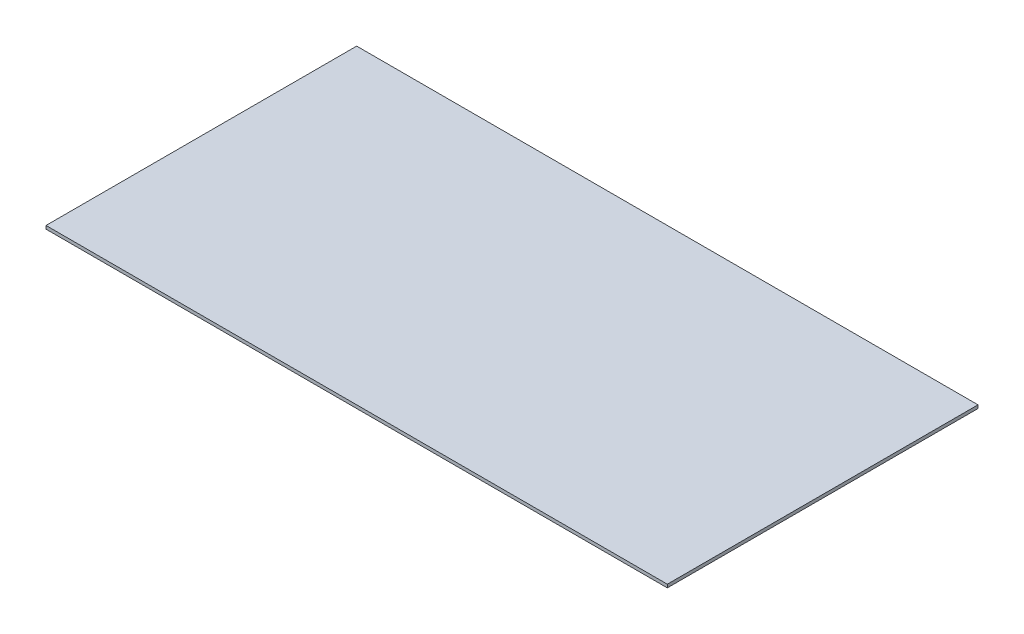
from build123d import *

# Parameters (mm, degrees)
SKETCH1_W           = 1219.2
SKETCH1_H           = 609.6
BOSS_EXTRUDE1_DEPTH = 6.35


with BuildPart() as part:
    # Sketch1 → Boss-Extrude1 (new body)
    with BuildSketch(Plane(origin=(0, 0, 0), x_dir=(1, 0, 0), z_dir=(0, 1, 0))):
        Rectangle(SKETCH1_W, SKETCH1_H)
    extrude(amount=BOSS_EXTRUDE1_DEPTH)


solid = part.part
